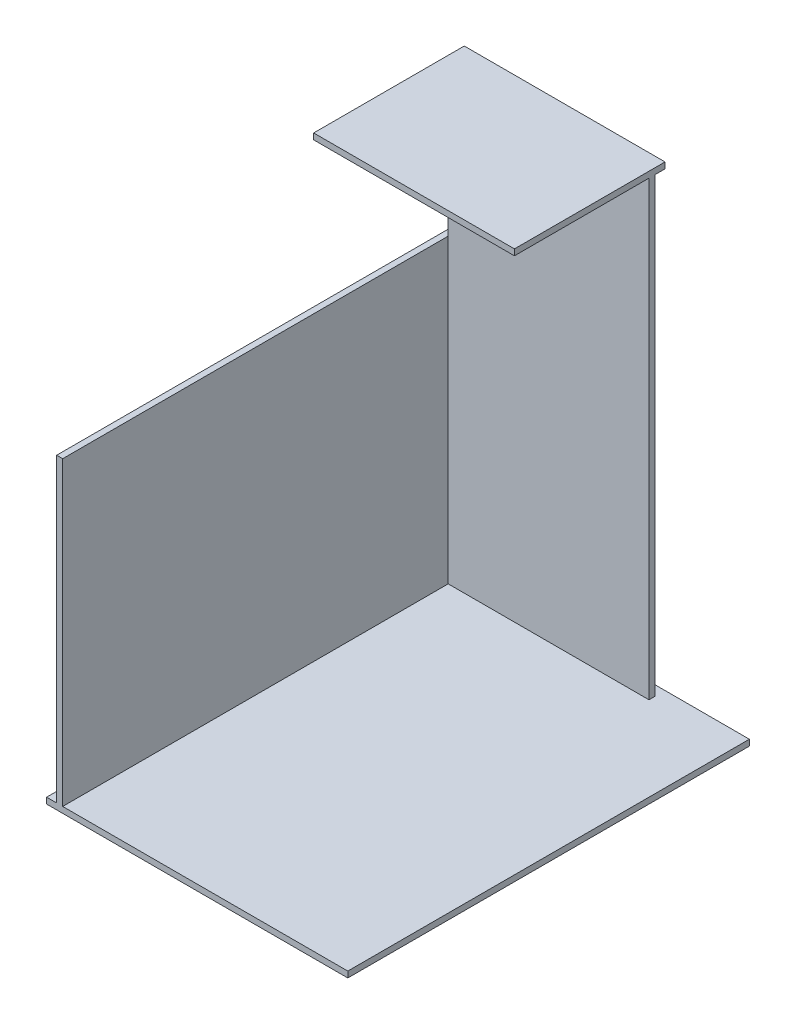
from build123d import *

# Parameters (mm, degrees)
SKETCH1_W           = 300
SKETCH1_H           = 400
BOSS_EXTRUDE1_DEPTH = 6
SKETCH2_W           = 6
SKETCH2_H           = 400
BOSS_EXTRUDE2_DEPTH = 300
SKETCH3_W           = 200
SKETCH3_H           = 6
BOSS_EXTRUDE3_DEPTH = 450
SKETCH5_W           = 200
SKETCH5_H           = 150
BOSS_EXTRUDE4_DEPTH = 6


with BuildPart() as part:
    # Sketch1 → Boss-Extrude1 (new body)
    with BuildSketch(Plane(origin=(0, 0, 0), x_dir=(1, 0, 0), z_dir=(0, 1, 0))):
        Rectangle(SKETCH1_W, SKETCH1_H)
    extrude(amount=BOSS_EXTRUDE1_DEPTH)

    # Sketch2 → Boss-Extrude2 (add)
    with BuildSketch(Plane(origin=(0, 6, 0), x_dir=(1, 0, 0), z_dir=(0, 1, 0))):
        with Locations((-137, 0)):
            Rectangle(SKETCH2_W, SKETCH2_H)
    extrude(amount=BOSS_EXTRUDE2_DEPTH)

    # Sketch3 → Boss-Extrude3 (add)
    with BuildSketch(Plane(origin=(0, 6, 0), x_dir=(1, 0, 0), z_dir=(0, 1, 0))):
        with Locations((-34, 187)):
            Rectangle(SKETCH3_W, SKETCH3_H)
    extrude(amount=BOSS_EXTRUDE3_DEPTH)

    # Sketch5 → Boss-Extrude4 (add)
    with BuildSketch(Plane(origin=(0, 456, 0), x_dir=(1, 0, 0), z_dir=(0, 1, 0))):
        with Locations((-34, 125)):
            Rectangle(SKETCH5_W, SKETCH5_H)
    extrude(amount=BOSS_EXTRUDE4_DEPTH)


solid = part.part
